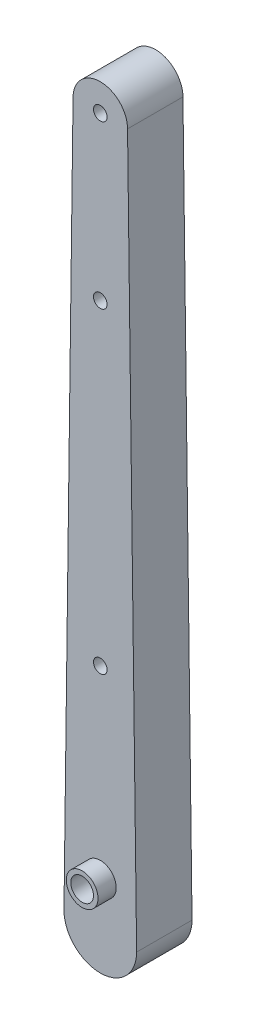
from build123d import *

# Parameters (mm, degrees)
SKETCH1_R           = 1.5
SKETCH1_R_2         = 2.5
BOSS_EXTRUDE2_DEPTH = 12.2
SKETCH3_R           = 3.5
SKETCH3_R_2         = 2.5
EXTRUDE_THIN1_DEPTH = 4
SKETCH4_R           = 1.5
CUT_EXTRUDE1_DEPTH  = 20


with BuildPart() as part:
    # Sketch1 → Boss-Extrude2 (new body)
    with BuildSketch(Plane.XY):
        with BuildLine():
            Line((6, 78), (8, -78))
            ThreePointArc((8, -78), (0, -86), (-8, -78))
            Line((-8, -78), (-6, 78))
            ThreePointArc((-6, 78), (0, 84), (6, 78))
        make_face()
        with Locations((0, 78)):
            Circle(SKETCH1_R, mode=Mode.SUBTRACT)
        with Locations((0, -68)):
            Circle(SKETCH1_R_2, mode=Mode.SUBTRACT)
    extrude(amount=BOSS_EXTRUDE2_DEPTH)

    # Sketch4 → Cut-Extrude1 (cut)
    with BuildSketch(Plane(origin=(0, 0, 0), x_dir=(-1, 0, 0), z_dir=(0, 0, -1))):
        with Locations((0, 42.26275725)):
            Circle(SKETCH4_R)
        with Locations((0, -27.421243353)):
            Circle(SKETCH4_R)
    extrude(amount=-CUT_EXTRUDE1_DEPTH, mode=Mode.SUBTRACT)


with BuildPart() as body_2:
    # Sketch3 → Extrude-Thin1 (new body)
    with BuildSketch(Plane.XY.offset(12.2)):
        with Locations((0, -68)):
            Circle(SKETCH3_R)
        with Locations((0, -68)):
            Circle(SKETCH3_R_2, mode=Mode.SUBTRACT)
    extrude(amount=EXTRUDE_THIN1_DEPTH)


solid = Compound([part.part, body_2.part])
